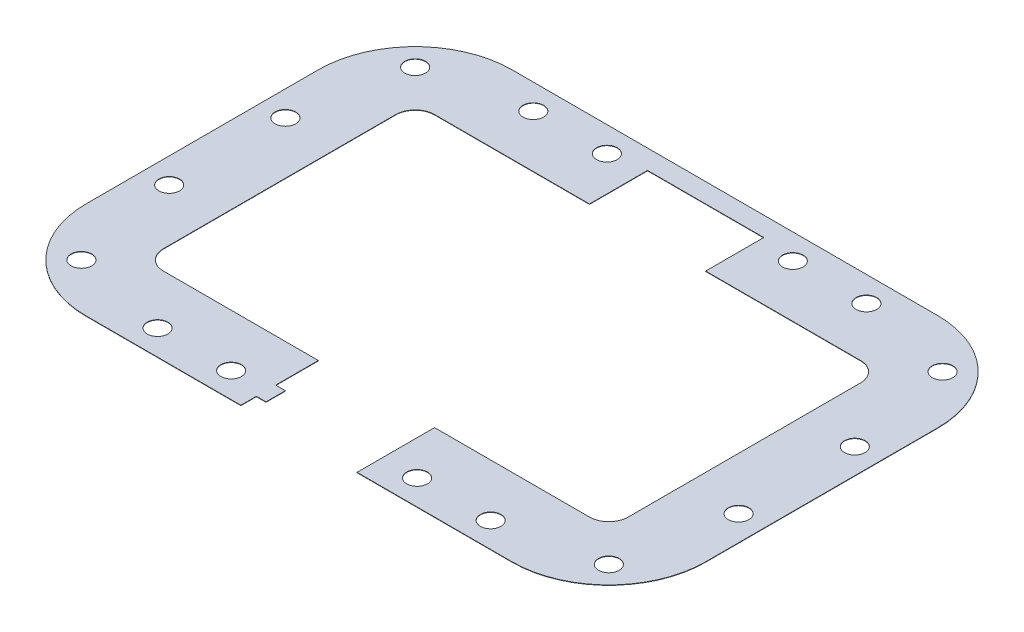
from build123d import *

# Parameters (mm, degrees)
SKETCH1_W                = 203.2
SKETCH1_H                = 139.7
BASE_EXTRUDE_DEPTH       = 0.127
SKETCH2_W                = 152.4
SKETCH2_H                = 88.9
CENTER_CUT_DEPTH         = 124.294763186
SKETCH3_W                = 38.1
SKETCH3_H                = 215.9
VETICAL_CUT_DEPTH        = 124.294763186
FILLET_1_R               = 31.75
SKETCH4_W                = 6.35
SKETCH4_H                = 6.35
SQUARE_EXTRUDE_DEPTH     = 0.127
SKETCH7_R                = 3.3782
CIRCULAR_EXTRUDE_DEPTH   = 124.294763186
MIRROR_2_COPY_1_SKETCH_R = 3.3782
MIRROR_2_COPY_1_DEPTH    = 124.294763186
FILLET_2_R               = 6.35


with BuildPart() as part:
    # Sketch1 → Base Extrude (new body)
    with BuildSketch(Plane(origin=(0, 0, 0), x_dir=(1, 0, 0), z_dir=(0, 1, 0))):
        Rectangle(SKETCH1_W, SKETCH1_H)
    extrude(amount=BASE_EXTRUDE_DEPTH)

    # Sketch2 → Center Cut (cut, through all)
    with BuildSketch(Plane(origin=(0, 0.127, 0), x_dir=(1, 0, 0), z_dir=(0, 1, 0))):
        Rectangle(SKETCH2_W, SKETCH2_H)
    extrude(amount=-CENTER_CUT_DEPTH, mode=Mode.SUBTRACT)

    # Sketch3 → Vetical Cut (cut, through all)
    with BuildSketch(Plane(origin=(0, 0.127, 0), x_dir=(1, 0, 0), z_dir=(0, 1, 0))):
        with Locations((0, -44.45)):
            Rectangle(SKETCH3_W, SKETCH3_H)
    extrude(amount=-VETICAL_CUT_DEPTH, mode=Mode.SUBTRACT)

    # Fillet 1
    fillet_1_edges = [part.edges().sort_by_distance(p)[0] for p in [
        (-101.6, 0.0635, -69.85),
        (101.6, 0.0635, -69.85),
        (101.6, 0.0635, 69.85),
        (-101.6, 0.0635, 69.85),
    ]]
    fillet(fillet_1_edges, radius=FILLET_1_R)

    # Sketch4 → Square Extrude (add)
    with BuildSketch(Plane(origin=(0, 0.127, 0), x_dir=(1, 0, 0), z_dir=(0, 1, 0))):
        with Locations((-19.05, -61.595)):
            Rectangle(SKETCH4_W, SKETCH4_H)
    extrude(amount=-SQUARE_EXTRUDE_DEPTH)

    # Sketch7 → Circular Extrude (cut, through all)
    with BuildSketch(Plane(origin=(0, 0.127, 0), x_dir=(1, 0, 0), z_dir=(0, 1, 0))):
        with Locations(Location((-93.345, -19.05, 0), (0, 0, 270))):
            Circle(SKETCH7_R)
        with Locations(Location((-86.463473824, -54.713473824, 0), (0, 0, 270))):
            Circle(SKETCH7_R)
        with Locations(Location((-30.48, -61.595, 0), (0, 0, 270))):
            Circle(SKETCH7_R)
        with Locations(Location((-54.61, -61.595, 0), (0, 0, 270))):
            Circle(SKETCH7_R)
    circular_extrude = extrude(amount=-CIRCULAR_EXTRUDE_DEPTH, mode=Mode.SUBTRACT)

    # Mirror 1: Circular Extrude across plane
    add(circular_extrude.mirror(Plane(origin=(0, 0, 0), x_dir=(0, 0, 1), z_dir=(1, 0, 0))), mode=Mode.SUBTRACT)

    # Mirror 2: Circular Extrude across plane
    add(circular_extrude.mirror(Plane.XY), mode=Mode.SUBTRACT)

    # Mirror 2 copy 1 sketch → Mirror 2 copy 1 (cut, through all)
    with BuildSketch(Plane(origin=(0, 0.127, 0), x_dir=(-1, 0, 0), z_dir=(0, 1, 0))):
        with Locations(Location((-93.345, -19.05, 0), (0, 0, 270))):
            Circle(MIRROR_2_COPY_1_SKETCH_R)
        with Locations(Location((-86.463473824, -54.713473824, 0), (0, 0, 270))):
            Circle(MIRROR_2_COPY_1_SKETCH_R)
        with Locations(Location((-30.48, -61.595, 0), (0, 0, 270))):
            Circle(MIRROR_2_COPY_1_SKETCH_R)
        with Locations(Location((-54.61, -61.595, 0), (0, 0, 270))):
            Circle(MIRROR_2_COPY_1_SKETCH_R)
    extrude(amount=-MIRROR_2_COPY_1_DEPTH, mode=Mode.SUBTRACT)

    # Fillet 2
    fillet_2_edges = [part.edges().sort_by_distance(p)[0] for p in [
        (-76.2, 0.0635, 44.45),
        (-76.2, 0.0635, -44.45),
        (76.2, 0.0635, -44.45),
        (76.2, 0.0635, 44.45),
    ]]
    fillet(fillet_2_edges, radius=FILLET_2_R)


solid = part.part
